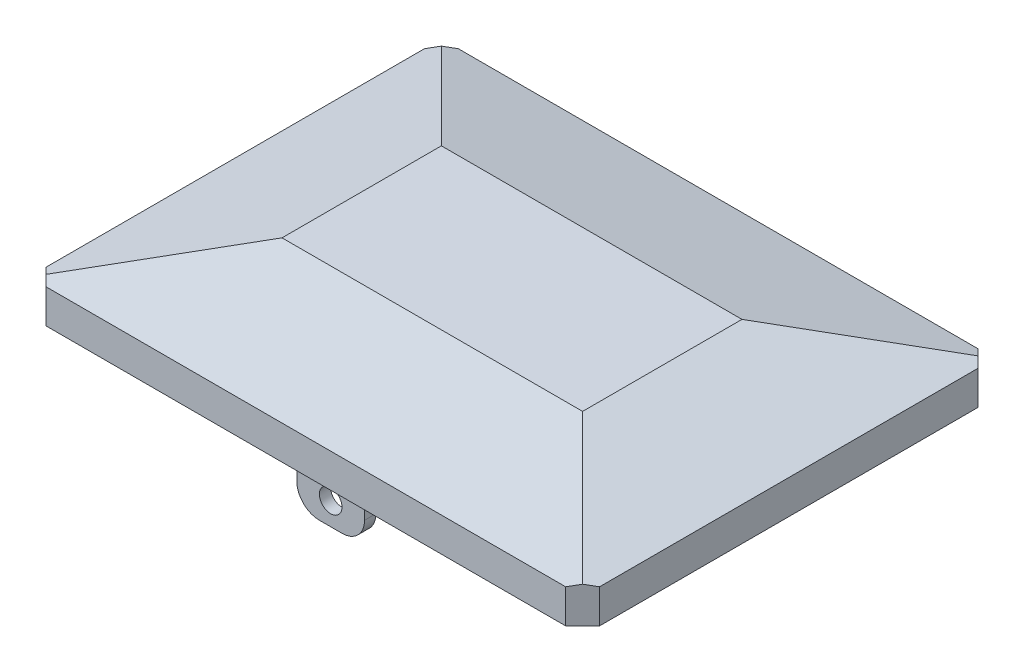
from build123d import *

# Parameters (mm, degrees)
SKETCH1_W             = 24.5
SKETCH1_H             = 18.25
BOSS_EXTRUDE1_DEPTH   = 3
CHAMFER1_SIZE         = 0.75
CHAMFER2_SIZE         = 1.5
CHAMFER2_SIZE2        = 5.598076211
CHAMFER2_PART_2_SIZE  = 1.5
CHAMFER2_PART_2_SIZE2 = 5.598076211
CHAMFER2_PART_3_SIZE  = 1.5
CHAMFER2_PART_3_SIZE2 = 5.598076211
CHAMFER2_PART_4_SIZE  = 1.5
CHAMFER2_PART_4_SIZE2 = 5.598076211
SKETCH4_W             = 3
SKETCH4_H             = 0.5
BOSS_EXTRUDE2_DEPTH   = 2.5
FILLET2_R             = 1
FILLET2_OF_MIRROR2_R  = 1
SKETCH5_R             = 0.75
BOSS_EXTRUDE3_DEPTH   = 0.5
CUT_EXTRUDE2_REACH    = 23.288
SKETCH6_R             = 0.5


with BuildPart() as part:
    # Sketch1 → Boss-Extrude1 (new body)
    with BuildSketch(Plane(origin=(0, 0, 0), x_dir=(1, 0, 0), z_dir=(0, 1, 0))):
        Rectangle(SKETCH1_W, SKETCH1_H)
    extrude(amount=BOSS_EXTRUDE1_DEPTH)

    # Chamfer1
    chamfer1_edges = [part.edges().sort_by_distance(p)[0] for p in [
        (12.25, 1.5, 9.125),
        (-12.25, 1.5, 9.125),
        (-12.25, 1.5, -9.125),
        (12.25, 1.5, -9.125),
    ]]
    chamfer(chamfer1_edges, length=CHAMFER1_SIZE)

    # Chamfer2
    chamfer2_edges = [part.edges().sort_by_distance(p)[0] for p in [
        (12.25, 3, 0),
    ]]
    chamfer2_side = [part.faces().sort_by_distance(p)[0] for p in [
        (12.25, 1.5, 0),
    ]]
    chamfer(chamfer2_edges, length=CHAMFER2_SIZE, length2=CHAMFER2_SIZE2, reference=chamfer2_side[0])

    # Chamfer2 part 2
    chamfer2_part_2_edges = [part.edges().sort_by_distance(p)[0] for p in [
        (0, 3, 9.125),
    ]]
    chamfer2_part_2_side = [part.faces().sort_by_distance(p)[0] for p in [
        (0, 1.5, 9.125),
    ]]
    chamfer(chamfer2_part_2_edges, length=CHAMFER2_PART_2_SIZE, length2=CHAMFER2_PART_2_SIZE2, reference=chamfer2_part_2_side[0])

    # Chamfer2 part 3
    chamfer2_part_3_edges = [part.edges().sort_by_distance(p)[0] for p in [
        (-12.25, 3, 0),
    ]]
    chamfer2_part_3_side = [part.faces().sort_by_distance(p)[0] for p in [
        (-12.25, 1.5, 0),
    ]]
    chamfer(chamfer2_part_3_edges, length=CHAMFER2_PART_3_SIZE, length2=CHAMFER2_PART_3_SIZE2, reference=chamfer2_part_3_side[0])

    # Chamfer2 part 4
    chamfer2_part_4_edges = [part.edges().sort_by_distance(p)[0] for p in [
        (0, 3, -9.125),
    ]]
    chamfer2_part_4_side = [part.faces().sort_by_distance(p)[0] for p in [
        (0, 1.5, -9.125),
    ]]
    chamfer(chamfer2_part_4_edges, length=CHAMFER2_PART_4_SIZE, length2=CHAMFER2_PART_4_SIZE2, reference=chamfer2_part_4_side[0])

    # Sketch4 → Boss-Extrude2 (add)
    with BuildSketch(Plane.XZ):
        with Locations((0, 7.775)):
            Rectangle(SKETCH4_W, SKETCH4_H)
    boss_extrude2 = extrude(amount=BOSS_EXTRUDE2_DEPTH)

    # Fillet2
    fillet2_edges = [part.edges().sort_by_distance(p)[0] for p in [
        (-1.5, -2.5, 7.775),
        (1.5, -2.5, 7.775),
    ]]
    fillet(fillet2_edges, radius=FILLET2_R)

    # Mirror2: Boss-Extrude2 across plane
    add(boss_extrude2.mirror(Plane.XY))

    # Fillet2 of Mirror2
    fillet2_of_mirror2_edges = [part.edges().sort_by_distance(p)[0] for p in [
        (-1.5, -2.5, -7.775),
        (1.5, -2.5, -7.775),
    ]]
    fillet(fillet2_of_mirror2_edges, radius=FILLET2_OF_MIRROR2_R)

    # Sketch5 → Boss-Extrude3 (add)
    with BuildSketch(Plane(origin=(0, 0, -8.025), x_dir=(-1, 0, 0), z_dir=(0, 0, -1))):
        with Locations((0, -1.5)):
            Circle(SKETCH5_R)
    extrude(amount=BOSS_EXTRUDE3_DEPTH)

    # Sketch6 → Cut-Extrude2 (cut, up to next)
    with BuildSketch(Plane.XY.offset(8.025), mode=Mode.PRIVATE) as cut_extrude2_sk1:
        with Locations((0, -1.5)):
            Circle(SKETCH6_R)
    cut_extrude2_tool1 = extrude(cut_extrude2_sk1.sketch, amount=-CUT_EXTRUDE2_REACH, mode=Mode.PRIVATE) & part.part
    add(cut_extrude2_tool1.solids().sort_by_distance((0, -1.5, 8.025))[0], mode=Mode.SUBTRACT)


solid = part.part
